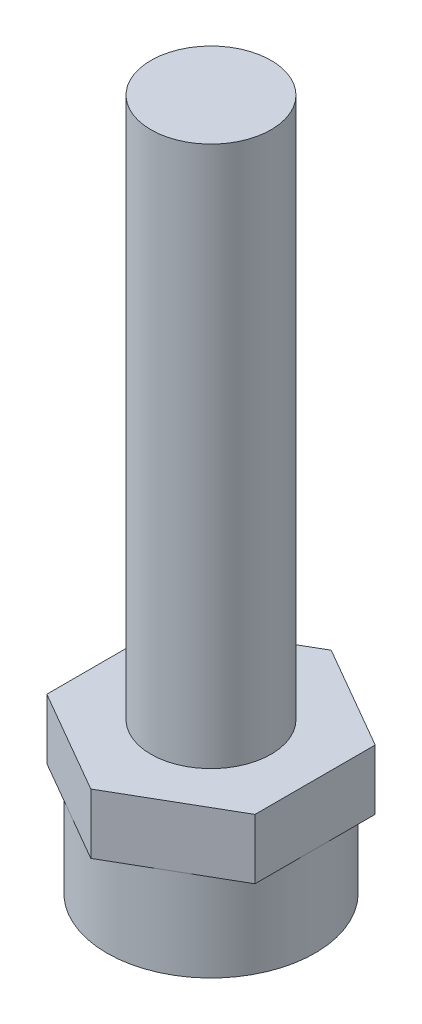
from build123d import *

# Parameters (mm, degrees)
SKETCH1_R           = 1
BOSS_EXTRUDE1_DEPTH = 10
SKETCH1_4_R         = 1.732050808
BOSS_EXTRUDE2_DEPTH = 1.5
SKETCH1_5_R         = 1
BOSS_EXTRUDE3_DEPTH = 1


with BuildPart() as part:
    # Sketch1 → Boss-Extrude1 (new body)
    with BuildSketch(Plane(origin=(0, 0, 0), x_dir=(1, 0, 0), z_dir=(0, 1, 0))):
        Circle(SKETCH1_R)
    extrude(amount=BOSS_EXTRUDE1_DEPTH)

    # Sketch1<4> → Boss-Extrude2 (add)
    with BuildSketch(Plane(origin=(0, 0, 0), x_dir=(1, 0, 0), z_dir=(0, 1, 0))):
        Circle(SKETCH1_4_R)
    extrude(amount=-BOSS_EXTRUDE2_DEPTH)


with BuildPart() as body_2:
    # Sketch1<5> → Boss-Extrude3 (new body)
    with BuildSketch(Plane(origin=(0, 0, 0), x_dir=(1, 0, 0), z_dir=(0, 1, 0))):
        Polygon((0, 2), (-1.732050808, 1), (-1.732050808, -1), (0, -2), (1.732050808, -1), (1.732050808, 1), align=None)
        Circle(SKETCH1_5_R, mode=Mode.SUBTRACT)
    extrude(amount=BOSS_EXTRUDE3_DEPTH)


solid = Compound([part.part, body_2.part])
